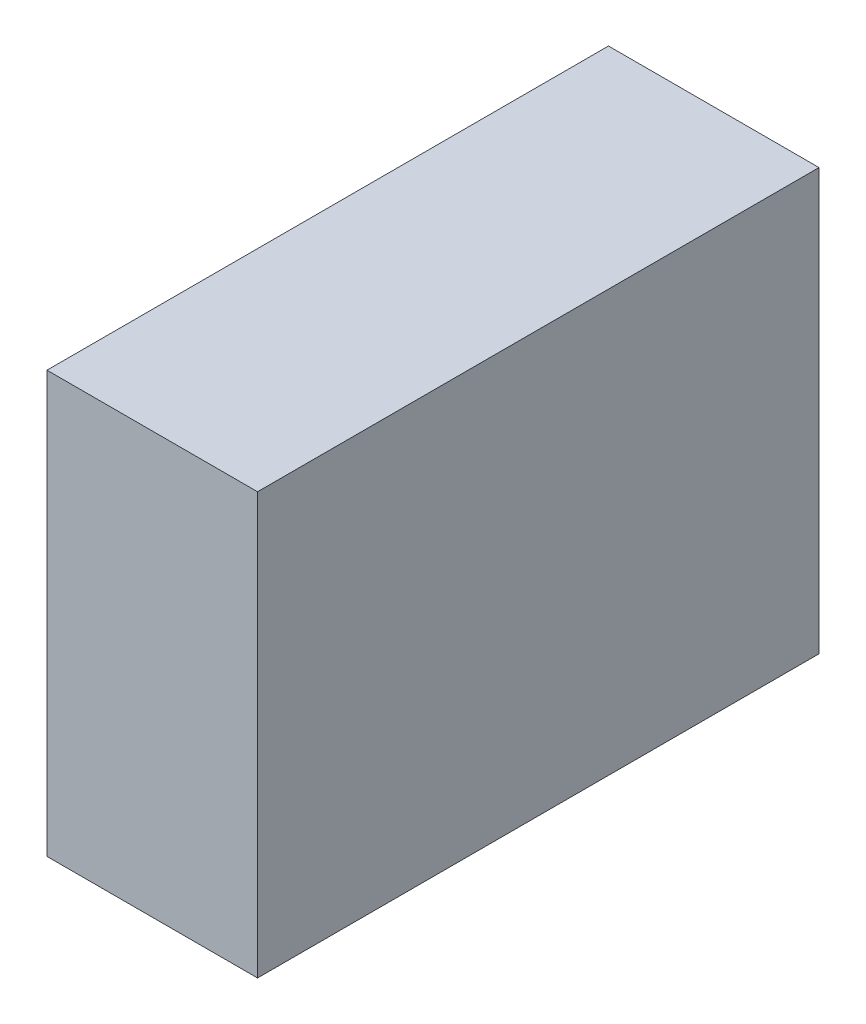
from build123d import *

# Parameters (mm, degrees)
SKETCH1_W           = 57.15
SKETCH1_H           = 114.3
BOSS_EXTRUDE1_DEPTH = 152.4


with BuildPart() as part:
    # Sketch1 → Boss-Extrude1 (new body)
    with BuildSketch(Plane.XY):
        with Locations((28.575, 57.15)):
            Rectangle(SKETCH1_W, SKETCH1_H)
    extrude(amount=BOSS_EXTRUDE1_DEPTH)


solid = part.part
